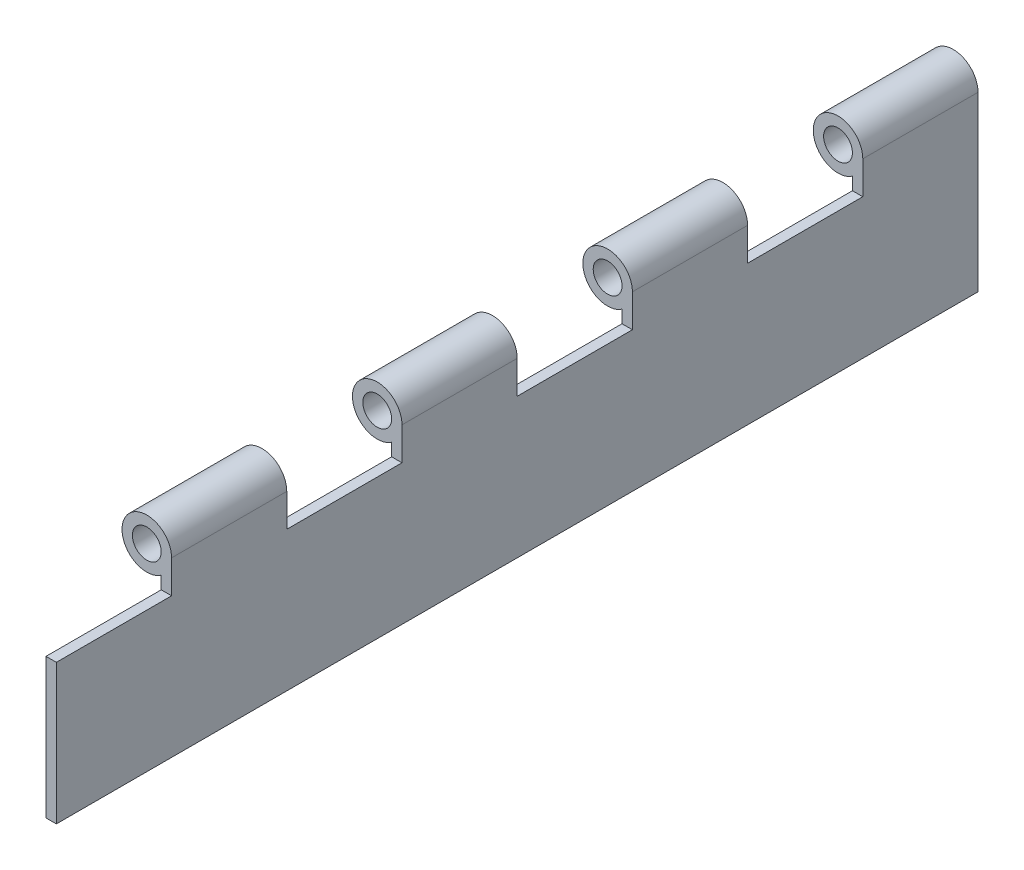
from build123d import *

# Parameters (mm, degrees)
SKETCH1_R           = 3.175
BOSS_EXTRUDE1_DEPTH = 203.2
SKETCH2_W           = 25.4
SKETCH2_H           = 12.7
CUT_EXTRUDE1_DEPTH  = 208.029321798
LPATTERN1_COUNT     = 4
LPATTERN1_PITCH     = 50.8


with BuildPart() as part:
    # Sketch1 → Boss-Extrude1 (new body)
    with BuildSketch(Plane.XY):
        with BuildLine():
            Line((5.461, 0), (5.461, -38.1))
            Line((5.461, -38.1), (3.175, -38.1))
            Line((3.175, -38.1), (3.175, -4.443185344))
            ThreePointArc((3.175, -4.443185344), (-4.855985791, 2.498384078), (5.461, 0))
        make_face()
        Circle(SKETCH1_R, mode=Mode.SUBTRACT)
    extrude(amount=BOSS_EXTRUDE1_DEPTH)

    # Sketch2 → Cut-Extrude1 (cut, through all)
    with BuildSketch(Plane(origin=(5.461, 0, 0), x_dir=(0, 0, -1), z_dir=(1, 0, 0))):
        with Locations((-190.5, -0.889)):
            Rectangle(SKETCH2_W, SKETCH2_H)
    cut_extrude1 = extrude(amount=-CUT_EXTRUDE1_DEPTH, mode=Mode.SUBTRACT)

    # LPattern1: Cut-Extrude1 ×4
    with Locations(*[(0, 0, -i * LPATTERN1_PITCH) for i in range(1, LPATTERN1_COUNT)]):
        add(cut_extrude1, mode=Mode.SUBTRACT)


solid = part.part
